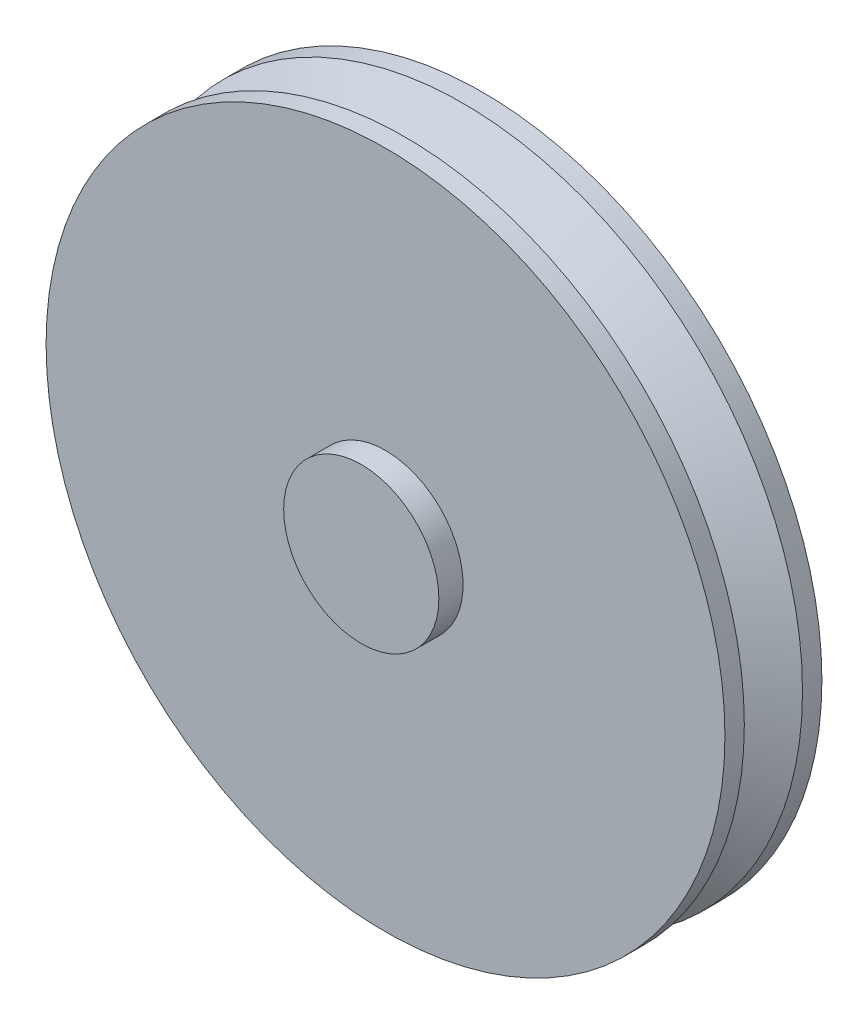
from build123d import *

# Parameters (mm, degrees)
SKETCH1_R           = 44.45
BOSS_EXTRUDE1_DEPTH = 2.54
SKETCH2_R           = 38.1
SKETCH3_R           = 10.16
BOSS_EXTRUDE2_DEPTH = 3.175


with BuildPart() as part:
    # Sketch1 → Boss-Extrude1 (new body)
    with BuildSketch(Plane.XY):
        Circle(SKETCH1_R)
    extrude(amount=BOSS_EXTRUDE1_DEPTH)

    # Sketch2 → section 1 of loft1
    with BuildSketch(Plane.XY.offset(6.35), mode=Mode.PRIVATE) as loft1_s1:
        Circle(SKETCH2_R)
    # loft up to a face of the part (loft1)
    loft([Face(Wire([part.edges().sort_by_distance((-30.428118859, 32.402655489, 2.54))[0]])), loft1_s1.sketch])

    # Mirror3: part across plane


with BuildPart() as part_1:
    add(part.part)
    add(part.part.mirror(Plane.XY.offset(6.35)))

    # Sketch3 → Boss-Extrude2 (add)
    with BuildSketch(Plane.XY.offset(12.7)):
        with Locations(Location((0, 0, 0), (0, 0, 180))):
            Circle(SKETCH3_R)
    extrude(amount=BOSS_EXTRUDE2_DEPTH)


solid = part_1.part
